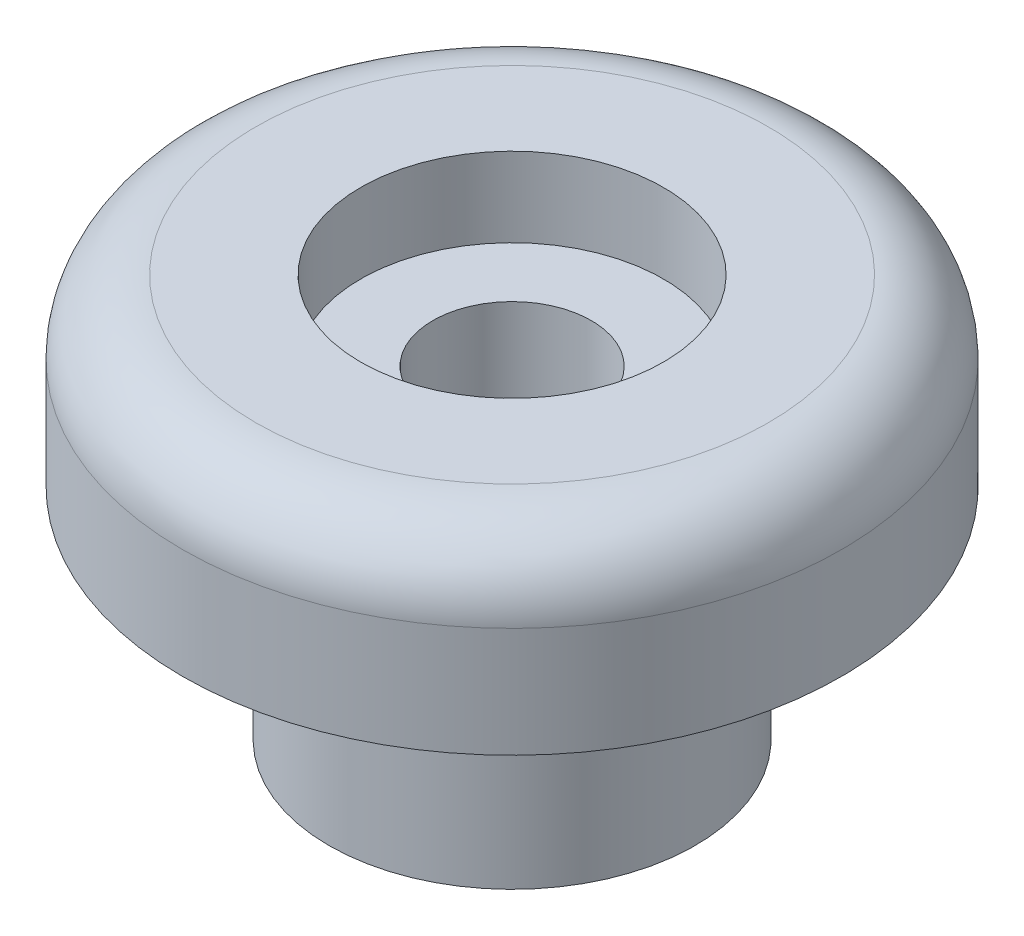
from build123d import *

# Parameters (mm, degrees)
SKETCH1_R                       = 6.35
BOSS_EXTRUDE1_DEPTH             = 8.89
BOSS_EXTRUDE2_DEPTH             = 5.08
BOSS_EXTRUDE2_DEPTH_BACK        = 1.27
SKETCH2_R                       = 11.43
CBORE_FOR_M5_SBHCS1_D           = 5.5
CBORE_FOR_M5_SBHCS1_CBORE_D     = 10.5
CBORE_FOR_M5_SBHCS1_CBORE_DEPTH = 2.75
FILLET1_R                       = 2.54


with BuildPart() as part:
    # Sketch1 → Boss-Extrude1 (new body)
    with BuildSketch(Plane(origin=(0, 0, 0), x_dir=(1, 0, 0), z_dir=(0, 1, 0))):
        with Locations(Location((0, 0, 0), (0, 0, 270))):
            Circle(SKETCH1_R)
    extrude(amount=BOSS_EXTRUDE1_DEPTH)

    # Sketch2 → Boss-Extrude2 (add, two sides: drawn at the far end of the back side and taken through both)
    with BuildSketch(Plane(origin=(0, 8.89, 0), x_dir=(1, 0, 0), z_dir=(0, 1, 0)).offset(-BOSS_EXTRUDE2_DEPTH_BACK)):
        with Locations(Location((0, 0, 0), (0, 0, 270))):
            Circle(SKETCH2_R)
    extrude(amount=BOSS_EXTRUDE2_DEPTH + BOSS_EXTRUDE2_DEPTH_BACK)

    # CBORE for M5 SBHCS1 (through all)
    with Locations(Plane(origin=(0, 13.97, 0), x_dir=(1, 0, 0), z_dir=(0, 1, 0))):
        with Locations((0, 0)):
            CounterBoreHole(CBORE_FOR_M5_SBHCS1_D / 2, CBORE_FOR_M5_SBHCS1_CBORE_D / 2, CBORE_FOR_M5_SBHCS1_CBORE_DEPTH)

    # Fillet1
    fillet1_edges = [part.edges().sort_by_distance(p)[0] for p in [
        (0, 13.97, -11.43),
    ]]
    fillet(fillet1_edges, radius=FILLET1_R)


solid = part.part
